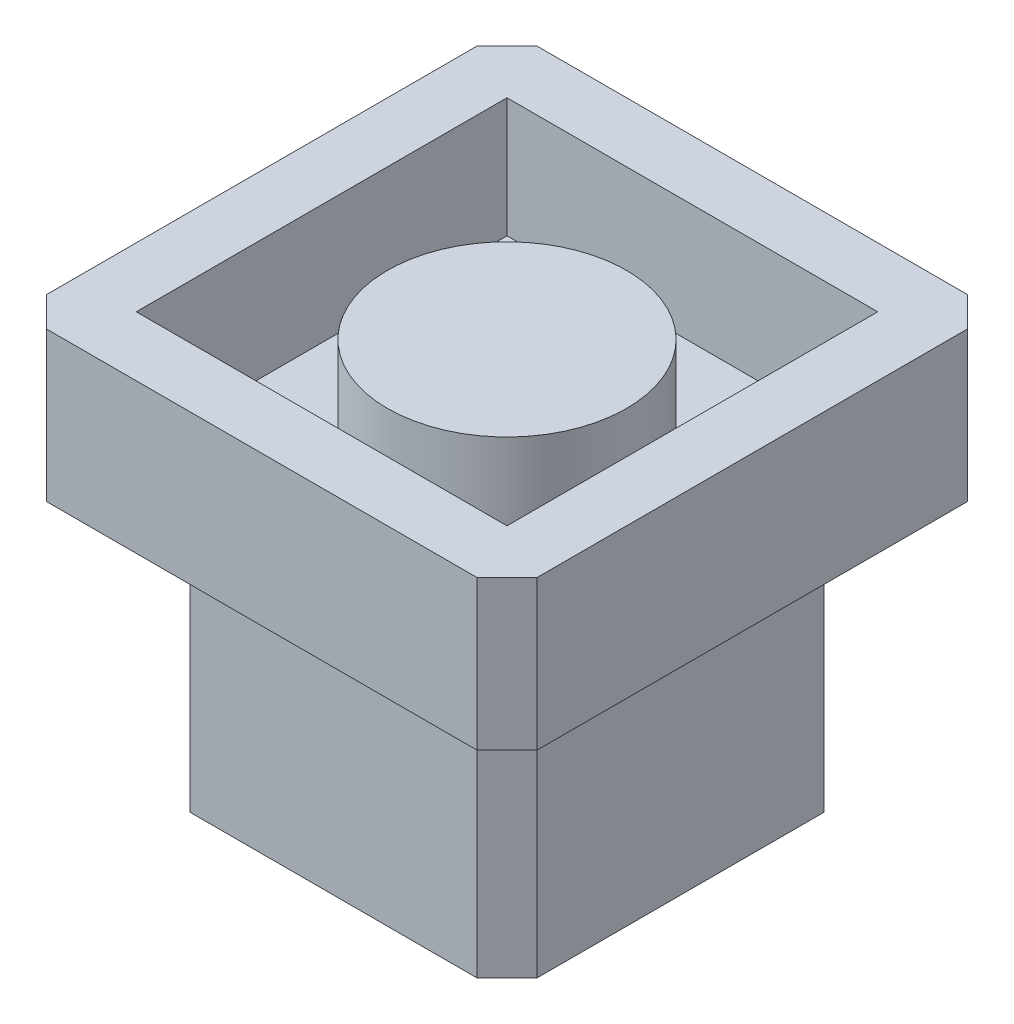
from build123d import *

# Parameters (mm, degrees)
SKETCH1_R           = 2
BOSS_EXTRUDE1_DEPTH = 1.6
SKETCH1_3_W         = 8.2
SKETCH1_3_H         = 8.2
SKETCH1_3_W_2       = 6.2
SKETCH1_3_H_2       = 6.2
BOSS_EXTRUDE2_DEPTH = 2
SKETCH1_4_W         = 8.2
SKETCH1_4_H         = 8.2
BOSS_EXTRUDE3_DEPTH = 0.5
SKETCH3_W           = 5.8
SKETCH3_H           = 5.8
BOSS_EXTRUDE4_DEPTH = 4.5
CHAMFER1_SIZE       = 0.5
CUT_EXTRUDE1_DEPTH  = 0.2


with BuildPart() as part:
    # Sketch1 → Boss-Extrude1 (new body)
    with BuildSketch(Plane(origin=(0, 0, 0), x_dir=(1, 0, 0), z_dir=(0, 1, 0))):
        Circle(SKETCH1_R)
    extrude(amount=BOSS_EXTRUDE1_DEPTH)



with BuildPart() as body_2:
    # Sketch1<3> → Boss-Extrude2 (new body)
    with BuildSketch(Plane(origin=(0, 0, 0), x_dir=(1, 0, 0), z_dir=(0, 1, 0))):
        Rectangle(SKETCH1_3_W, SKETCH1_3_H)
        Rectangle(SKETCH1_3_W_2, SKETCH1_3_H_2, mode=Mode.SUBTRACT)
    extrude(amount=BOSS_EXTRUDE2_DEPTH)


with BuildPart() as part_1:
    add(part.part)

    add(body_2.part)  # Boss-Extrude3 merges body 2
    # Sketch1<4> → Boss-Extrude3 (add)
    with BuildSketch(Plane(origin=(0, 0, 0), x_dir=(1, 0, 0), z_dir=(0, 1, 0))):
        Rectangle(SKETCH1_4_W, SKETCH1_4_H)
    extrude(amount=-BOSS_EXTRUDE3_DEPTH)

    # Sketch3 → Boss-Extrude4 (add)
    with BuildSketch(Plane.XZ.offset(0.5)):
        Rectangle(SKETCH3_W, SKETCH3_H)
    extrude(amount=BOSS_EXTRUDE4_DEPTH)

    # Chamfer1
    chamfer1_edges = [part_1.edges().sort_by_distance(p)[0] for p in [
        (-4.1, 0.75, -4.1),
        (4.1, 0.75, -4.1),
        (-4.1, 0.75, 4.1),
        (4.1, 0.75, 4.1),
        (-2.9, -2.75, 2.9),
        (2.9, -2.75, 2.9),
        (-2.9, -2.75, -2.9),
        (2.9, -2.75, -2.9),
    ]]
    chamfer(chamfer1_edges, length=CHAMFER1_SIZE)

    # Sketch4 → Cut-Extrude1 (cut)
    with BuildSketch(Plane.XZ.offset(5)):
        with BuildLine():
            Line((-0.810649843, 2.028880102), (-0.127757215, 2.028880102))
            add(Edge.make_bspline(
                [(-0.127757215, 2.028880102), (-0.094328737, 2.028704351), (-0.029536026, 2.028363703), (0.064683416, 2.023080572), (0.152932226, 2.015876902), (0.235235999, 2.00444681), (0.311556701, 1.990655032), (0.382124338, 1.973953216), (0.44671451, 1.953926603), (0.523827247, 1.922080321), (0.611747908, 1.874757153), (0.7069463, 1.804828588), (0.78835054, 1.719296125), (0.858536857, 1.622813469), (0.914337977, 1.516677698), (0.954707274, 1.403418509), (0.980265149, 1.284496767), (0.982893584, 1.202853589), (0.984221952, 1.161592441)],
                knots=[0, 0, 0, 0, 1.001505555, 1.941167018, 2.826882275, 3.653841531, 4.429895133, 5.150066043, 5.825578002, 6.45369114, 7.647487171, 8.808567382, 9.977351308, 11.170798116, 12.373658725, 13.556498008, 14.765093433, 16, 16, 16, 16], degree=3))
            add(Edge.make_bspline(
                [(0.984221952, 1.161592441), (0.983128733, 1.122939886), (0.980980456, 1.046983969), (0.960437697, 0.935889859), (0.928277028, 0.830138641), (0.883571779, 0.730116255), (0.825469783, 0.638082642), (0.756611464, 0.553295376), (0.673534662, 0.479344319), (0.611291422, 0.438001416), (0.579674676, 0.417001095)],
                knots=[0, 0, 0, 0, 1.044552857, 2.05264487, 3.044412934, 4.028983338, 5.005914585, 5.980388656, 6.974128949, 8, 8, 8, 8], degree=3))
            add(Edge.make_bspline(
                [(0.579674676, 0.417001095), (0.619435104, 0.401736096), (0.695506651, 0.372530372), (0.800192664, 0.320894908), (0.890387509, 0.264732798), (0.966784655, 0.203400947), (1.03212231, 0.137292137), (1.089175251, 0.065437022), (1.137856625, -0.013101736), (1.179569549, -0.097505271), (1.212118305, -0.186911739), (1.236494209, -0.280482515), (1.250461658, -0.377882071), (1.2524493, -0.44416745), (1.253452721, -0.477630315)],
                knots=[0, 0, 0, 0, 1.27268992, 2.434971085, 3.483601985, 4.442670788, 5.356604649, 6.2567628, 7.179492994, 8.113709626, 9.066344395, 10.018646069, 10.999752585, 12, 12, 12, 12], degree=3))
            add(Edge.make_bspline(
                [(1.253452721, -0.477630315), (1.252475875, -0.511797187), (1.250553903, -0.579021465), (1.236373931, -0.6777766), (1.212364824, -0.772151546), (1.179293678, -0.862756729), (1.136131363, -0.949416864), (1.083603399, -1.032230128), (1.020971835, -1.110364458), (0.950908966, -1.184688081), (0.871646821, -1.251515869), (0.786131066, -1.311031575), (0.693284746, -1.359977637), (0.594632752, -1.401093659), (0.489068436, -1.432500857), (0.377065829, -1.454473431), (0.258721527, -1.469278468), (0.177511776, -1.470495673), (0.13586458, -1.471119898)],
                knots=[0, 0, 0, 0, 0.978564426, 1.925352924, 2.850884081, 3.763762016, 4.682927383, 5.618979971, 6.567305752, 7.547517671, 8.540179244, 9.531824382, 10.526200242, 11.540722885, 12.589160233, 13.674978461, 14.80764778, 16, 16, 16, 16], degree=3))
            Line((0.13586458, -1.471119898), (-0.810649843, -1.471119898))
            Line((-0.810649843, -1.471119898), (-0.810649843, 2.028880102))
        make_face()
        with BuildLine():
            Line((-0.496547279, 1.669905743), (-0.496547279, 0.548110871))
            Line((-0.496547279, 0.548110871), (-0.285509619, 0.548110871))
            add(Edge.make_bspline(
                [(-0.285509619, 0.548110871), (-0.254660823, 0.548510794), (-0.195054664, 0.549283527), (-0.108734767, 0.551497044), (-0.028609749, 0.557695087), (0.045182084, 0.563891349), (0.112524528, 0.573965937), (0.173268389, 0.58595806), (0.228366986, 0.598640965), (0.291906532, 0.620210452), (0.36397948, 0.652088127), (0.440812584, 0.701559963), (0.508547054, 0.760484316), (0.565744242, 0.828475278), (0.612555712, 0.903341464), (0.645069427, 0.983888344), (0.667116712, 1.068108476), (0.669108243, 1.125926729), (0.670119388, 1.155282345)],
                knots=[0, 0, 0, 0, 1.156816544, 2.235205308, 3.236616184, 4.169592532, 5.011045266, 5.787822928, 6.49130361, 7.128639758, 8.301311294, 9.436451833, 10.541879658, 11.654887649, 12.756523258, 13.837046038, 14.901820046, 16, 16, 16, 16], degree=3))
            add(Edge.make_bspline(
                [(0.670119388, 1.155282345), (0.669593208, 1.174708117), (0.668561048, 1.212813889), (0.660107745, 1.268363243), (0.645740171, 1.320606996), (0.627285877, 1.370261106), (0.601497189, 1.415772956), (0.571133725, 1.458716152), (0.534448035, 1.49762827), (0.492690722, 1.533997769), (0.4446821, 1.566242296), (0.390450808, 1.59448306), (0.329263131, 1.617223836), (0.262150276, 1.637139989), (0.188079188, 1.651128283), (0.107904635, 1.66278167), (0.020969916, 1.668714412), (-0.039175187, 1.669499775), (-0.070265228, 1.669905743)],
                knots=[0, 0, 0, 0, 0.91205012, 1.789085906, 2.630437955, 3.453916878, 4.269457761, 5.079663411, 5.91843418, 6.774407191, 7.675494373, 8.627863946, 9.638891023, 10.736472738, 11.911756761, 13.175263542, 14.539845004, 16, 16, 16, 16], degree=3))
            Line((-0.070265228, 1.669905743), (-0.496547279, 1.669905743))
        make_face(mode=Mode.SUBTRACT)
        with BuildLine():
            Line((-0.496547279, 0.189136512), (-0.496547279, -1.112145539))
            Line((-0.496547279, -1.112145539), (-0.049231574, -1.112145539))
            add(Edge.make_bspline(
                [(-0.049231574, -1.112145539), (-0.017212648, -1.111761792), (0.044499611, -1.111022169), (0.133600841, -1.108607615), (0.216183945, -1.103115339), (0.29187208, -1.09446949), (0.361482533, -1.08509104), (0.424180236, -1.072479759), (0.480473429, -1.058030799), (0.545747737, -1.035696627), (0.619251245, -1.001000156), (0.698462102, -0.948685929), (0.76888832, -0.886362622), (0.828693579, -0.814231707), (0.877706568, -0.73580038), (0.913362023, -0.65265503), (0.93535288, -0.566169503), (0.938015049, -0.507202791), (0.939350157, -0.477630315)],
                knots=[0, 0, 0, 0, 1.160039823, 2.235823828, 3.228722157, 4.157150951, 4.99529583, 5.772374946, 6.472645482, 7.099169577, 8.269452708, 9.405989375, 10.527446681, 11.663510218, 12.788923519, 13.866172445, 14.929861265, 16, 16, 16, 16], degree=3))
            add(Edge.make_bspline(
                [(0.939350157, -0.477630315), (0.939074053, -0.459136974), (0.938526298, -0.422448593), (0.930265683, -0.368532773), (0.918251813, -0.3163069), (0.902720379, -0.26562916), (0.880100912, -0.217415783), (0.853694367, -0.170713224), (0.822732965, -0.125459744), (0.774488799, -0.068247491), (0.704316815, -0.002330478), (0.604610039, 0.062207024), (0.491237741, 0.114254831), (0.409010249, 0.136354308), (0.366533651, 0.147770326)],
                knots=[0, 0, 0, 0, 0.723448775, 1.435228256, 2.130040452, 2.821711965, 3.505591119, 4.210454504, 4.921174351, 5.648778258, 7.137944449, 8.670945889, 10.280296675, 12, 12, 12, 12], degree=3))
            add(Edge.make_bspline(
                [(0.366533651, 0.147770326), (0.349504555, 0.15122541), (0.312581962, 0.158716745), (0.252374382, 0.166624448), (0.183638513, 0.173669508), (0.106215636, 0.178880666), (0.020007795, 0.184267209), (-0.075169124, 0.18636203), (-0.178926439, 0.18886129), (-0.250918811, 0.189042425), (-0.288314106, 0.189136512)],
                knots=[0, 0, 0, 0, 0.634451884, 1.375622551, 2.216452059, 3.157844607, 4.20941857, 5.370758133, 6.634282058, 8, 8, 8, 8], degree=3))
            Line((-0.288314106, 0.189136512), (-0.496547279, 0.189136512))
        make_face(mode=Mode.SUBTRACT)
    extrude(amount=-CUT_EXTRUDE1_DEPTH, mode=Mode.SUBTRACT)


solid = part_1.part
